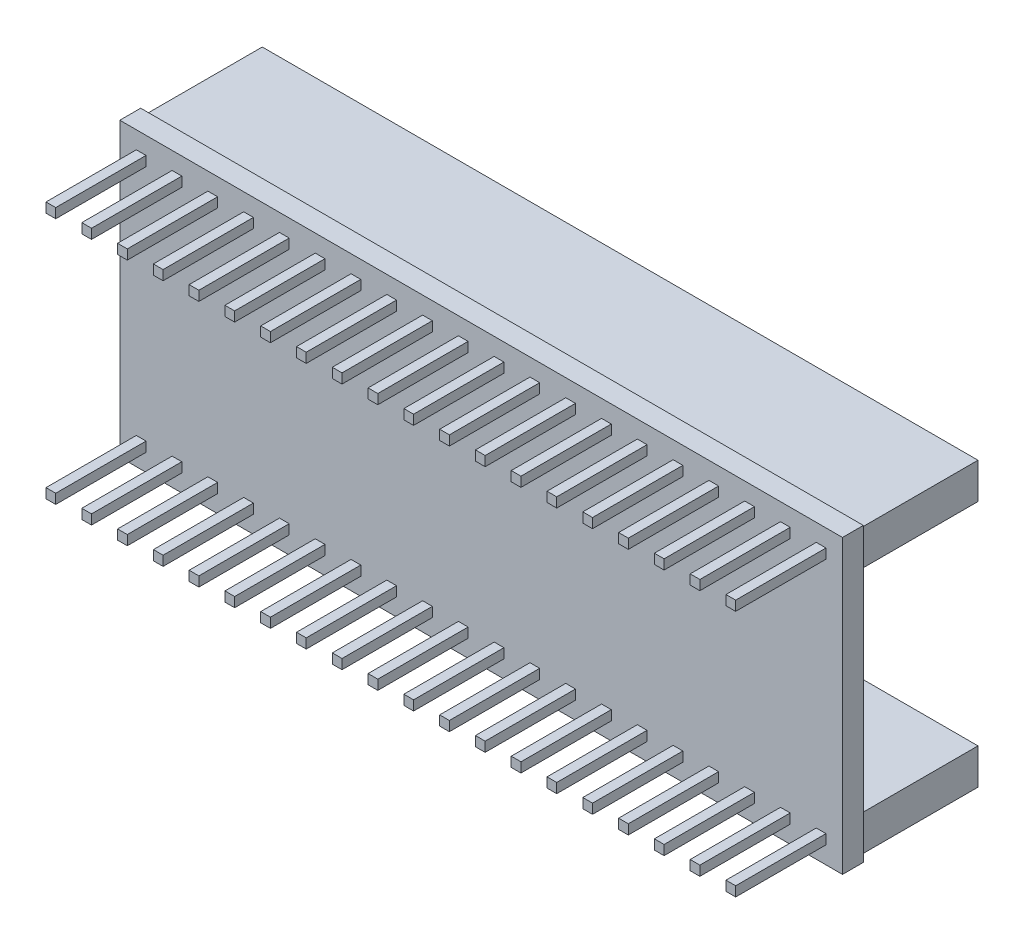
from build123d import *

# Parameters (mm, degrees)
SKETCH_1_W      = 52
SKETCH_1_H      = 21
SKETCH_1_W_2    = 0.7
SKETCH_1_H_2    = 0.7
EXTRUDE_1_DEPTH = 1.5
SKETCH_1_4_W    = 51.5
SKETCH_1_4_H    = 2.575
SKETCH_1_4_W_2  = 0.7
SKETCH_1_4_H_2  = 0.7
EXTRUDE_2_DEPTH = 8.5
SKETCH_1_5_W    = 0.7
SKETCH_1_5_H    = 0.7
EXTRUDE_3_DEPTH = 8


with BuildPart() as part:
    # Эскиз1 → Бобышка-Вытянуть1 (new body)
    with BuildSketch(Plane.XY):
        with Locations((-26, 10.5)):
            Rectangle(SKETCH_1_W, SKETCH_1_H)
        with Locations((-1.5375, 1.6)):
            Rectangle(SKETCH_1_W_2, SKETCH_1_H_2, mode=Mode.SUBTRACT)
        with Locations((-50.4625, 1.6)):
            Rectangle(SKETCH_1_W_2, SKETCH_1_H_2, mode=Mode.SUBTRACT)
        with Locations((-47.8875, 1.6)):
            Rectangle(SKETCH_1_W_2, SKETCH_1_H_2, mode=Mode.SUBTRACT)
        with Locations((-45.3125, 1.6)):
            Rectangle(SKETCH_1_W_2, SKETCH_1_H_2, mode=Mode.SUBTRACT)
        with Locations((-42.7375, 1.6)):
            Rectangle(SKETCH_1_W_2, SKETCH_1_H_2, mode=Mode.SUBTRACT)
        with Locations((-40.1625, 1.6)):
            Rectangle(SKETCH_1_W_2, SKETCH_1_H_2, mode=Mode.SUBTRACT)
        with Locations((-37.5875, 1.6)):
            Rectangle(SKETCH_1_W_2, SKETCH_1_H_2, mode=Mode.SUBTRACT)
        with Locations((-35.0125, 1.6)):
            Rectangle(SKETCH_1_W_2, SKETCH_1_H_2, mode=Mode.SUBTRACT)
        with Locations((-32.4375, 1.6)):
            Rectangle(SKETCH_1_W_2, SKETCH_1_H_2, mode=Mode.SUBTRACT)
        with Locations((-29.8625, 1.6)):
            Rectangle(SKETCH_1_W_2, SKETCH_1_H_2, mode=Mode.SUBTRACT)
        with Locations((-27.2875, 1.6)):
            Rectangle(SKETCH_1_W_2, SKETCH_1_H_2, mode=Mode.SUBTRACT)
        with Locations((-24.7125, 1.6)):
            Rectangle(SKETCH_1_W_2, SKETCH_1_H_2, mode=Mode.SUBTRACT)
        with Locations((-22.1375, 1.6)):
            Rectangle(SKETCH_1_W_2, SKETCH_1_H_2, mode=Mode.SUBTRACT)
        with Locations((-19.5625, 1.6)):
            Rectangle(SKETCH_1_W_2, SKETCH_1_H_2, mode=Mode.SUBTRACT)
        with Locations((-16.9875, 1.6)):
            Rectangle(SKETCH_1_W_2, SKETCH_1_H_2, mode=Mode.SUBTRACT)
        with Locations((-14.4125, 1.6)):
            Rectangle(SKETCH_1_W_2, SKETCH_1_H_2, mode=Mode.SUBTRACT)
        with Locations((-11.8375, 1.6)):
            Rectangle(SKETCH_1_W_2, SKETCH_1_H_2, mode=Mode.SUBTRACT)
        with Locations((-9.2625, 1.6)):
            Rectangle(SKETCH_1_W_2, SKETCH_1_H_2, mode=Mode.SUBTRACT)
        with Locations((-6.6875, 1.6)):
            Rectangle(SKETCH_1_W_2, SKETCH_1_H_2, mode=Mode.SUBTRACT)
        with Locations((-4.1125, 1.6)):
            Rectangle(SKETCH_1_W_2, SKETCH_1_H_2, mode=Mode.SUBTRACT)
        with Locations((-1.5375, 19.4)):
            Rectangle(SKETCH_1_W_2, SKETCH_1_H_2, mode=Mode.SUBTRACT)
        with Locations((-50.4625, 19.4)):
            Rectangle(SKETCH_1_W_2, SKETCH_1_H_2, mode=Mode.SUBTRACT)
        with Locations((-47.8875, 19.4)):
            Rectangle(SKETCH_1_W_2, SKETCH_1_H_2, mode=Mode.SUBTRACT)
        with Locations((-45.3125, 19.4)):
            Rectangle(SKETCH_1_W_2, SKETCH_1_H_2, mode=Mode.SUBTRACT)
        with Locations((-42.7375, 19.4)):
            Rectangle(SKETCH_1_W_2, SKETCH_1_H_2, mode=Mode.SUBTRACT)
        with Locations((-40.1625, 19.4)):
            Rectangle(SKETCH_1_W_2, SKETCH_1_H_2, mode=Mode.SUBTRACT)
        with Locations((-37.5875, 19.4)):
            Rectangle(SKETCH_1_W_2, SKETCH_1_H_2, mode=Mode.SUBTRACT)
        with Locations((-35.0125, 19.4)):
            Rectangle(SKETCH_1_W_2, SKETCH_1_H_2, mode=Mode.SUBTRACT)
        with Locations((-32.4375, 19.4)):
            Rectangle(SKETCH_1_W_2, SKETCH_1_H_2, mode=Mode.SUBTRACT)
        with Locations((-29.8625, 19.4)):
            Rectangle(SKETCH_1_W_2, SKETCH_1_H_2, mode=Mode.SUBTRACT)
        with Locations((-27.2875, 19.4)):
            Rectangle(SKETCH_1_W_2, SKETCH_1_H_2, mode=Mode.SUBTRACT)
        with Locations((-24.7125, 19.4)):
            Rectangle(SKETCH_1_W_2, SKETCH_1_H_2, mode=Mode.SUBTRACT)
        with Locations((-22.1375, 19.4)):
            Rectangle(SKETCH_1_W_2, SKETCH_1_H_2, mode=Mode.SUBTRACT)
        with Locations((-19.5625, 19.4)):
            Rectangle(SKETCH_1_W_2, SKETCH_1_H_2, mode=Mode.SUBTRACT)
        with Locations((-16.9875, 19.4)):
            Rectangle(SKETCH_1_W_2, SKETCH_1_H_2, mode=Mode.SUBTRACT)
        with Locations((-14.4125, 19.4)):
            Rectangle(SKETCH_1_W_2, SKETCH_1_H_2, mode=Mode.SUBTRACT)
        with Locations((-11.8375, 19.4)):
            Rectangle(SKETCH_1_W_2, SKETCH_1_H_2, mode=Mode.SUBTRACT)
        with Locations((-9.2625, 19.4)):
            Rectangle(SKETCH_1_W_2, SKETCH_1_H_2, mode=Mode.SUBTRACT)
        with Locations((-6.6875, 19.4)):
            Rectangle(SKETCH_1_W_2, SKETCH_1_H_2, mode=Mode.SUBTRACT)
        with Locations((-4.1125, 19.4)):
            Rectangle(SKETCH_1_W_2, SKETCH_1_H_2, mode=Mode.SUBTRACT)
    extrude(amount=EXTRUDE_1_DEPTH)

    # Эскиз1<4> → Бобышка-Вытянуть2 (add)
    # profile 1 of 2: a face of its own
    with BuildSketch(Plane.XY):
        with Locations((-26, 19.4)):
            Rectangle(SKETCH_1_4_W, SKETCH_1_4_H)
        with Locations((-50.4625, 19.4)):
            Rectangle(SKETCH_1_4_W_2, SKETCH_1_4_H_2, mode=Mode.SUBTRACT)
        with Locations((-47.8875, 19.4)):
            Rectangle(SKETCH_1_4_W_2, SKETCH_1_4_H_2, mode=Mode.SUBTRACT)
        with Locations((-45.3125, 19.4)):
            Rectangle(SKETCH_1_4_W_2, SKETCH_1_4_H_2, mode=Mode.SUBTRACT)
        with Locations((-42.7375, 19.4)):
            Rectangle(SKETCH_1_4_W_2, SKETCH_1_4_H_2, mode=Mode.SUBTRACT)
        with Locations((-40.1625, 19.4)):
            Rectangle(SKETCH_1_4_W_2, SKETCH_1_4_H_2, mode=Mode.SUBTRACT)
        with Locations((-37.5875, 19.4)):
            Rectangle(SKETCH_1_4_W_2, SKETCH_1_4_H_2, mode=Mode.SUBTRACT)
        with Locations((-35.0125, 19.4)):
            Rectangle(SKETCH_1_4_W_2, SKETCH_1_4_H_2, mode=Mode.SUBTRACT)
        with Locations((-32.4375, 19.4)):
            Rectangle(SKETCH_1_4_W_2, SKETCH_1_4_H_2, mode=Mode.SUBTRACT)
        with Locations((-29.8625, 19.4)):
            Rectangle(SKETCH_1_4_W_2, SKETCH_1_4_H_2, mode=Mode.SUBTRACT)
        with Locations((-27.2875, 19.4)):
            Rectangle(SKETCH_1_4_W_2, SKETCH_1_4_H_2, mode=Mode.SUBTRACT)
        with Locations((-24.7125, 19.4)):
            Rectangle(SKETCH_1_4_W_2, SKETCH_1_4_H_2, mode=Mode.SUBTRACT)
        with Locations((-22.1375, 19.4)):
            Rectangle(SKETCH_1_4_W_2, SKETCH_1_4_H_2, mode=Mode.SUBTRACT)
        with Locations((-19.5625, 19.4)):
            Rectangle(SKETCH_1_4_W_2, SKETCH_1_4_H_2, mode=Mode.SUBTRACT)
        with Locations((-16.9875, 19.4)):
            Rectangle(SKETCH_1_4_W_2, SKETCH_1_4_H_2, mode=Mode.SUBTRACT)
        with Locations((-14.4125, 19.4)):
            Rectangle(SKETCH_1_4_W_2, SKETCH_1_4_H_2, mode=Mode.SUBTRACT)
        with Locations((-11.8375, 19.4)):
            Rectangle(SKETCH_1_4_W_2, SKETCH_1_4_H_2, mode=Mode.SUBTRACT)
        with Locations((-9.2625, 19.4)):
            Rectangle(SKETCH_1_4_W_2, SKETCH_1_4_H_2, mode=Mode.SUBTRACT)
        with Locations((-6.6875, 19.4)):
            Rectangle(SKETCH_1_4_W_2, SKETCH_1_4_H_2, mode=Mode.SUBTRACT)
        with Locations((-4.1125, 19.4)):
            Rectangle(SKETCH_1_4_W_2, SKETCH_1_4_H_2, mode=Mode.SUBTRACT)
        with Locations((-1.5375, 19.4)):
            Rectangle(SKETCH_1_4_W_2, SKETCH_1_4_H_2, mode=Mode.SUBTRACT)
    # profile 2 of 2: a face of its own
    with BuildSketch(Plane.XY):
        with Locations((-26, 1.6)):
            Rectangle(SKETCH_1_4_W, SKETCH_1_4_H)
        with Locations((-50.4625, 1.6)):
            Rectangle(SKETCH_1_4_W_2, SKETCH_1_4_H_2, mode=Mode.SUBTRACT)
        with Locations((-47.8875, 1.6)):
            Rectangle(SKETCH_1_4_W_2, SKETCH_1_4_H_2, mode=Mode.SUBTRACT)
        with Locations((-45.3125, 1.6)):
            Rectangle(SKETCH_1_4_W_2, SKETCH_1_4_H_2, mode=Mode.SUBTRACT)
        with Locations((-42.7375, 1.6)):
            Rectangle(SKETCH_1_4_W_2, SKETCH_1_4_H_2, mode=Mode.SUBTRACT)
        with Locations((-40.1625, 1.6)):
            Rectangle(SKETCH_1_4_W_2, SKETCH_1_4_H_2, mode=Mode.SUBTRACT)
        with Locations((-37.5875, 1.6)):
            Rectangle(SKETCH_1_4_W_2, SKETCH_1_4_H_2, mode=Mode.SUBTRACT)
        with Locations((-35.0125, 1.6)):
            Rectangle(SKETCH_1_4_W_2, SKETCH_1_4_H_2, mode=Mode.SUBTRACT)
        with Locations((-32.4375, 1.6)):
            Rectangle(SKETCH_1_4_W_2, SKETCH_1_4_H_2, mode=Mode.SUBTRACT)
        with Locations((-29.8625, 1.6)):
            Rectangle(SKETCH_1_4_W_2, SKETCH_1_4_H_2, mode=Mode.SUBTRACT)
        with Locations((-27.2875, 1.6)):
            Rectangle(SKETCH_1_4_W_2, SKETCH_1_4_H_2, mode=Mode.SUBTRACT)
        with Locations((-24.7125, 1.6)):
            Rectangle(SKETCH_1_4_W_2, SKETCH_1_4_H_2, mode=Mode.SUBTRACT)
        with Locations((-22.1375, 1.6)):
            Rectangle(SKETCH_1_4_W_2, SKETCH_1_4_H_2, mode=Mode.SUBTRACT)
        with Locations((-19.5625, 1.6)):
            Rectangle(SKETCH_1_4_W_2, SKETCH_1_4_H_2, mode=Mode.SUBTRACT)
        with Locations((-16.9875, 1.6)):
            Rectangle(SKETCH_1_4_W_2, SKETCH_1_4_H_2, mode=Mode.SUBTRACT)
        with Locations((-14.4125, 1.6)):
            Rectangle(SKETCH_1_4_W_2, SKETCH_1_4_H_2, mode=Mode.SUBTRACT)
        with Locations((-11.8375, 1.6)):
            Rectangle(SKETCH_1_4_W_2, SKETCH_1_4_H_2, mode=Mode.SUBTRACT)
        with Locations((-9.2625, 1.6)):
            Rectangle(SKETCH_1_4_W_2, SKETCH_1_4_H_2, mode=Mode.SUBTRACT)
        with Locations((-6.6875, 1.6)):
            Rectangle(SKETCH_1_4_W_2, SKETCH_1_4_H_2, mode=Mode.SUBTRACT)
        with Locations((-4.1125, 1.6)):
            Rectangle(SKETCH_1_4_W_2, SKETCH_1_4_H_2, mode=Mode.SUBTRACT)
        with Locations((-1.5375, 1.6)):
            Rectangle(SKETCH_1_4_W_2, SKETCH_1_4_H_2, mode=Mode.SUBTRACT)
    extrude(amount=-EXTRUDE_2_DEPTH)

    # Эскиз1<5> → Бобышка-Вытянуть3 (add)
    with BuildSketch(Plane.XY):
        with Locations((-47.8875, 19.4)):
            Rectangle(SKETCH_1_5_W, SKETCH_1_5_H)
        with Locations((-50.4625, 19.4)):
            Rectangle(SKETCH_1_5_W, SKETCH_1_5_H)
        with Locations((-45.3125, 19.4)):
            Rectangle(SKETCH_1_5_W, SKETCH_1_5_H)
        with Locations((-42.7375, 19.4)):
            Rectangle(SKETCH_1_5_W, SKETCH_1_5_H)
        with Locations((-40.1625, 19.4)):
            Rectangle(SKETCH_1_5_W, SKETCH_1_5_H)
        with Locations((-37.5875, 19.4)):
            Rectangle(SKETCH_1_5_W, SKETCH_1_5_H)
        with Locations((-35.0125, 19.4)):
            Rectangle(SKETCH_1_5_W, SKETCH_1_5_H)
        with Locations((-32.4375, 19.4)):
            Rectangle(SKETCH_1_5_W, SKETCH_1_5_H)
        with Locations((-29.8625, 19.4)):
            Rectangle(SKETCH_1_5_W, SKETCH_1_5_H)
        with Locations((-27.2875, 19.4)):
            Rectangle(SKETCH_1_5_W, SKETCH_1_5_H)
        with Locations((-24.7125, 19.4)):
            Rectangle(SKETCH_1_5_W, SKETCH_1_5_H)
        with Locations((-22.1375, 19.4)):
            Rectangle(SKETCH_1_5_W, SKETCH_1_5_H)
        with Locations((-19.5625, 19.4)):
            Rectangle(SKETCH_1_5_W, SKETCH_1_5_H)
        with Locations((-16.9875, 19.4)):
            Rectangle(SKETCH_1_5_W, SKETCH_1_5_H)
        with Locations((-14.4125, 19.4)):
            Rectangle(SKETCH_1_5_W, SKETCH_1_5_H)
        with Locations((-11.8375, 19.4)):
            Rectangle(SKETCH_1_5_W, SKETCH_1_5_H)
        with Locations((-9.2625, 19.4)):
            Rectangle(SKETCH_1_5_W, SKETCH_1_5_H)
        with Locations((-6.6875, 19.4)):
            Rectangle(SKETCH_1_5_W, SKETCH_1_5_H)
        with Locations((-4.1125, 19.4)):
            Rectangle(SKETCH_1_5_W, SKETCH_1_5_H)
        with Locations((-1.5375, 19.4)):
            Rectangle(SKETCH_1_5_W, SKETCH_1_5_H)
        with Locations((-50.4625, 1.6)):
            Rectangle(SKETCH_1_5_W, SKETCH_1_5_H)
        with Locations((-47.8875, 1.6)):
            Rectangle(SKETCH_1_5_W, SKETCH_1_5_H)
        with Locations((-45.3125, 1.6)):
            Rectangle(SKETCH_1_5_W, SKETCH_1_5_H)
        with Locations((-42.7375, 1.6)):
            Rectangle(SKETCH_1_5_W, SKETCH_1_5_H)
        with Locations((-40.1625, 1.6)):
            Rectangle(SKETCH_1_5_W, SKETCH_1_5_H)
        with Locations((-37.5875, 1.6)):
            Rectangle(SKETCH_1_5_W, SKETCH_1_5_H)
        with Locations((-35.0125, 1.6)):
            Rectangle(SKETCH_1_5_W, SKETCH_1_5_H)
        with Locations((-32.4375, 1.6)):
            Rectangle(SKETCH_1_5_W, SKETCH_1_5_H)
        with Locations((-29.8625, 1.6)):
            Rectangle(SKETCH_1_5_W, SKETCH_1_5_H)
        with Locations((-27.2875, 1.6)):
            Rectangle(SKETCH_1_5_W, SKETCH_1_5_H)
        with Locations((-24.7125, 1.6)):
            Rectangle(SKETCH_1_5_W, SKETCH_1_5_H)
        with Locations((-22.1375, 1.6)):
            Rectangle(SKETCH_1_5_W, SKETCH_1_5_H)
        with Locations((-19.5625, 1.6)):
            Rectangle(SKETCH_1_5_W, SKETCH_1_5_H)
        with Locations((-16.9875, 1.6)):
            Rectangle(SKETCH_1_5_W, SKETCH_1_5_H)
        with Locations((-14.4125, 1.6)):
            Rectangle(SKETCH_1_5_W, SKETCH_1_5_H)
        with Locations((-11.8375, 1.6)):
            Rectangle(SKETCH_1_5_W, SKETCH_1_5_H)
        with Locations((-9.2625, 1.6)):
            Rectangle(SKETCH_1_5_W, SKETCH_1_5_H)
        with Locations((-6.6875, 1.6)):
            Rectangle(SKETCH_1_5_W, SKETCH_1_5_H)
        with Locations((-4.1125, 1.6)):
            Rectangle(SKETCH_1_5_W, SKETCH_1_5_H)
        with Locations((-1.5375, 1.6)):
            Rectangle(SKETCH_1_5_W, SKETCH_1_5_H)
    extrude(amount=EXTRUDE_3_DEPTH)


solid = part.part
